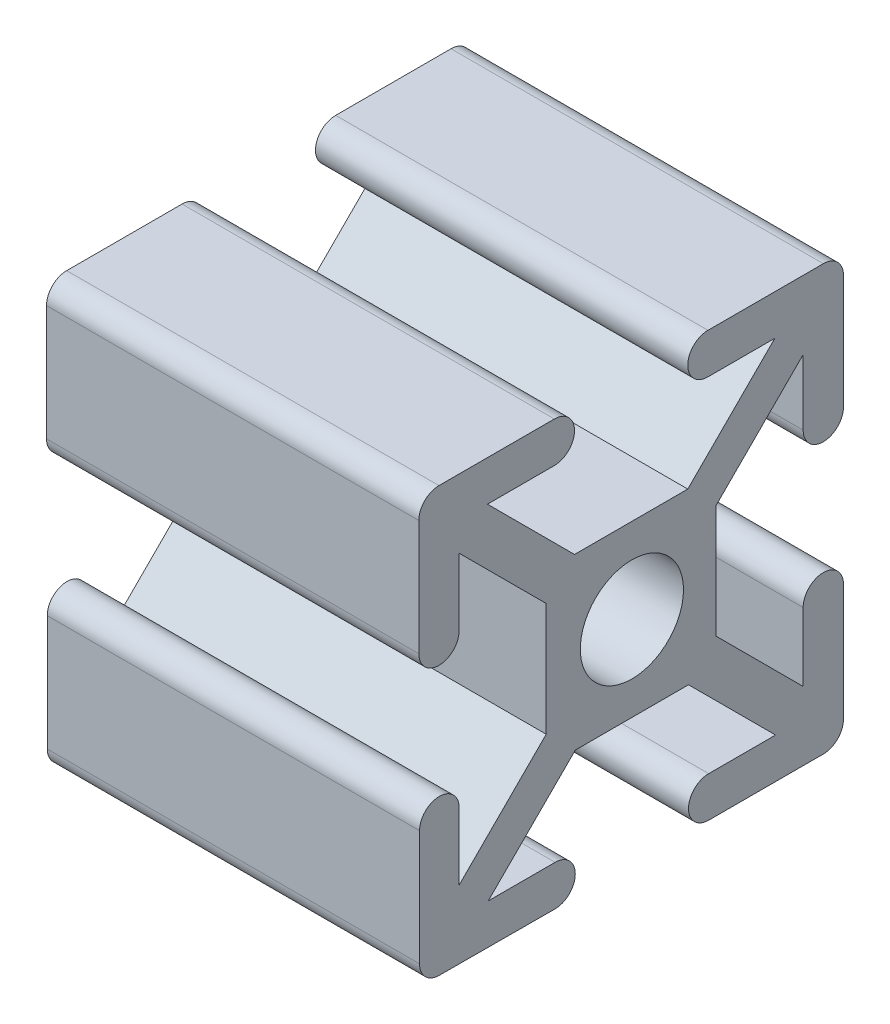
from build123d import *

# Parameters (mm, degrees)
CROQUIS1_R              = 3.645
SALIENTE_EXTRUIR1_DEPTH = 26.3


with BuildPart() as part:
    # Croquis1 → Saliente-Extruir1 (new body)
    with BuildSketch(Plane(origin=(0, 0, 0), x_dir=(0, 0, -1), z_dir=(1, 0, 0))):
        with BuildLine():
            Line((-14.240976213, -40.83193708), (-9.515976213, -40.83193708))
            Line((-9.515976213, -40.83193708), (-15.665976213, -34.68193708))
            Line((-15.665976213, -34.68193708), (-23.665976213, -34.68193708))
            Line((-23.665976213, -34.68193708), (-29.815976213, -40.83193708))
            Line((-29.815976213, -40.83193708), (-25.090976213, -40.83193708))
            ThreePointArc((-25.090976213, -40.83193708), (-23.665976213, -42.25693708), (-25.090976213, -43.68193708))
            Line((-25.090976213, -43.68193708), (-33.267411985, -43.655501308))
            ThreePointArc((-33.267411985, -43.655501308), (-34.256346235, -43.245871329), (-34.665976213, -42.25693708))
            Line((-34.665976213, -42.25693708), (-34.665976213, -34.10693708))
            ThreePointArc((-34.665976213, -34.10693708), (-33.267411985, -32.708372853), (-31.868847758, -34.10693708))
            Line((-31.868847758, -34.10693708), (-31.868847758, -38.83193708))
            Line((-31.868847758, -38.83193708), (-25.718847758, -32.68193708))
            Line((-25.718847758, -32.68193708), (-25.718847758, -24.68193708))
            Line((-25.718847758, -24.68193708), (-31.868847758, -18.53193708))
            Line((-31.868847758, -18.53193708), (-31.868847758, -23.25693708))
            ThreePointArc((-31.868847758, -23.25693708), (-33.293847758, -24.68193708), (-34.718847758, -23.25693708))
            Line((-34.718847758, -23.25693708), (-34.718847758, -15.10698367))
            ThreePointArc((-34.718847758, -15.10698367), (-34.301474921, -14.099356507), (-33.293847758, -13.68198367))
            Line((-33.293847758, -13.68198367), (-25.143847758, -13.68198367))
            ThreePointArc((-25.143847758, -13.68198367), (-23.718847758, -15.10698367), (-25.143847758, -16.53198367))
            Line((-25.143847758, -16.53198367), (-29.868847758, -16.53198367))
            Line((-29.868847758, -16.53198367), (-23.718847758, -22.68198367))
            Line((-23.718847758, -22.68198367), (-15.718847758, -22.68198367))
            Line((-15.718847758, -22.68198367), (-9.568847758, -16.53198367))
            Line((-9.568847758, -16.53198367), (-14.293847758, -16.53198367))
            ThreePointArc((-14.293847758, -16.53198367), (-15.718847758, -15.10698367), (-14.293847758, -13.68198367))
            Line((-14.293847758, -13.68198367), (-6.143847758, -13.68198367))
            ThreePointArc((-6.143847758, -13.68198367), (-5.136220595, -14.099356507), (-4.718847758, -15.10698367))
            Line((-4.718847758, -15.10698367), (-4.718847758, -23.153239985))
            ThreePointArc((-4.718847758, -23.153239985), (-6.143847758, -24.578239985), (-7.568847758, -23.153239985))
            Line((-7.568847758, -23.153239985), (-7.568847758, -18.53198367))
            Line((-7.568847758, -18.53198367), (-13.718847758, -24.68198367))
            Line((-13.718847758, -24.68198367), (-13.718847758, -32.68198367))
            Line((-13.718847758, -32.68198367), (-7.568847758, -38.83198367))
            Line((-7.568847758, -38.83198367), (-7.568847758, -34.003239985))
            ThreePointArc((-7.568847758, -34.003239985), (-6.143847758, -32.578239985), (-4.718847758, -34.003239985))
            Line((-4.718847758, -34.003239985), (-4.718847758, -42.25693708))
            ThreePointArc((-4.718847758, -42.25693708), (-5.136220595, -43.264564244), (-6.143847758, -43.68193708))
            Line((-6.143847758, -43.68193708), (-14.240976213, -43.68193708))
            ThreePointArc((-14.240976213, -43.68193708), (-15.665976213, -42.25693708), (-14.240976213, -40.83193708))
        make_face()
        with Locations((-19.665976213, -28.68193708)):
            Circle(CROQUIS1_R, mode=Mode.SUBTRACT)
    extrude(amount=SALIENTE_EXTRUIR1_DEPTH)


solid = part.part
